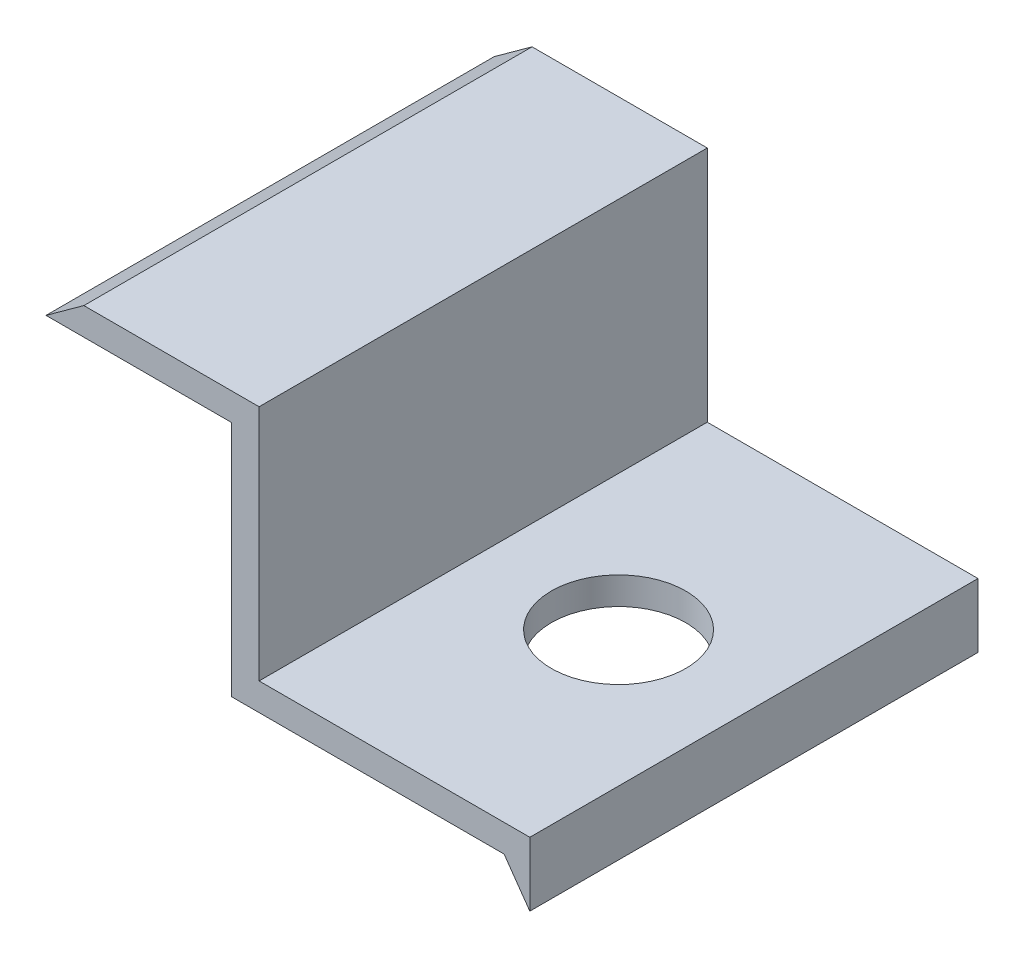
from build123d import *

# Parameters (mm, degrees)
BOSS_EXTRUDE1_DEPTH = 37.338
SKETCH3_R           = 5.596968057
CUT_EXTRUDE1_DEPTH  = 37.338


with BuildPart() as part:
    # Sketch2 → Boss-Extrude1 (new body)
    with BuildSketch(Plane.XY):
        Polygon((-33.242470299, 19.191529245), (-18.64445456, 19.191529245), (-18.64445456, -0.593055445), (3.910861921, -0.593055445), (3.910861921, -5.927055445), (1.768214677, -2.879055445), (-20.93045456, -2.879055445), (-20.93045456, 16.905529245), (-36.39768935, 16.905529245), align=None)
    extrude(amount=-BOSS_EXTRUDE1_DEPTH)

    # Sketch3 → Cut-Extrude1 (cut)
    with BuildSketch(Plane(origin=(0, -0.593055445, 0), x_dir=(1, 0, 0), z_dir=(0, 1, 0))):
        with Locations(Location((-7.36679632, 18.669, 0), (0, 0, 180))):
            Circle(SKETCH3_R)
    extrude(amount=-CUT_EXTRUDE1_DEPTH, mode=Mode.SUBTRACT)


solid = part.part
